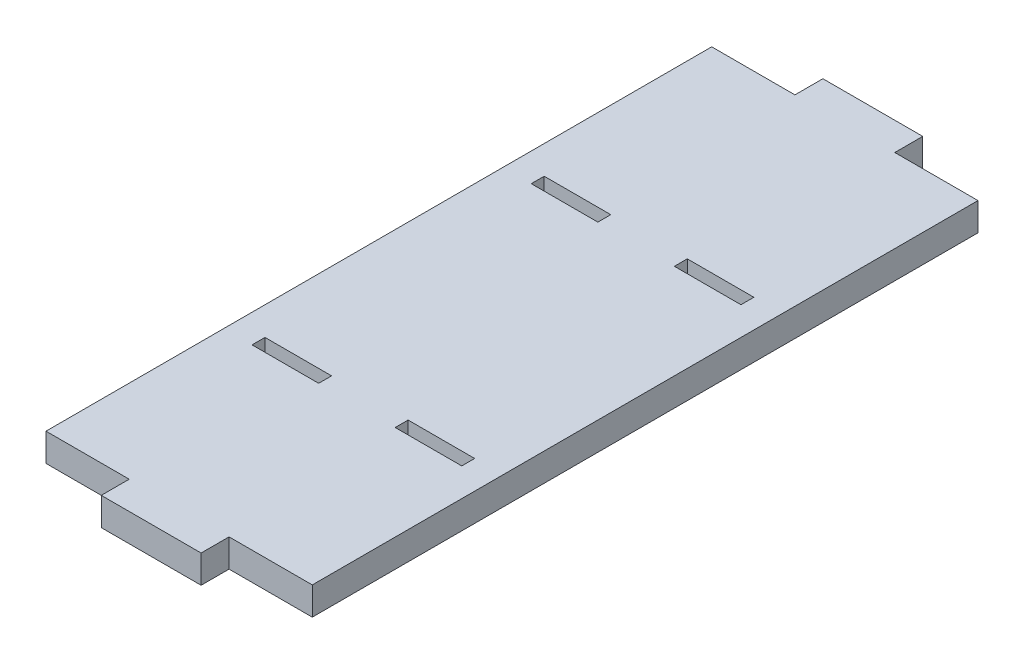
from build123d import *

# Parameters (mm, degrees)
SKETCH2_W          = 50.8
SKETCH2_H          = 127
BASE_DEPTH         = 5.334
SKETCH3_W          = 19.05
SKETCH3_H          = 5.334
TABS_DEPTH         = 5.334
SKETCH4_W          = 12.7
SKETCH4_H          = 2.4638
MOUNT_POINTS_DEPTH = 142.849847064


with BuildPart() as part:
    # Sketch2 → Base (new body)
    with BuildSketch(Plane(origin=(0, 0, 0), x_dir=(1, 0, 0), z_dir=(0, 1, 0))):
        with Locations((25.4, 63.5)):
            Rectangle(SKETCH2_W, SKETCH2_H)
    extrude(amount=BASE_DEPTH)

    # Sketch3 → Tabs (add)
    with BuildSketch(Plane.XY):
        with Locations((25.4, 2.667)):
            Rectangle(SKETCH3_W, SKETCH3_H)
    tabs = extrude(amount=TABS_DEPTH)

    # Tabs Mirror: Tabs across plane
    add(tabs.mirror(Plane.XY.offset(-63.5)))

    # Sketch4 → Mount Points (cut, through all)
    with BuildSketch(Plane.XZ):
        with Locations((11.75, -35.145453499)):
            Rectangle(SKETCH4_W, SKETCH4_H)
        with Locations((39.05, -35.145453499)):
            Rectangle(SKETCH4_W, SKETCH4_H)
        with Locations((11.75, -88.409253499)):
            Rectangle(SKETCH4_W, SKETCH4_H)
        with Locations((39.05, -88.409253499)):
            Rectangle(SKETCH4_W, SKETCH4_H)
    extrude(amount=-MOUNT_POINTS_DEPTH, mode=Mode.SUBTRACT)


solid = part.part
